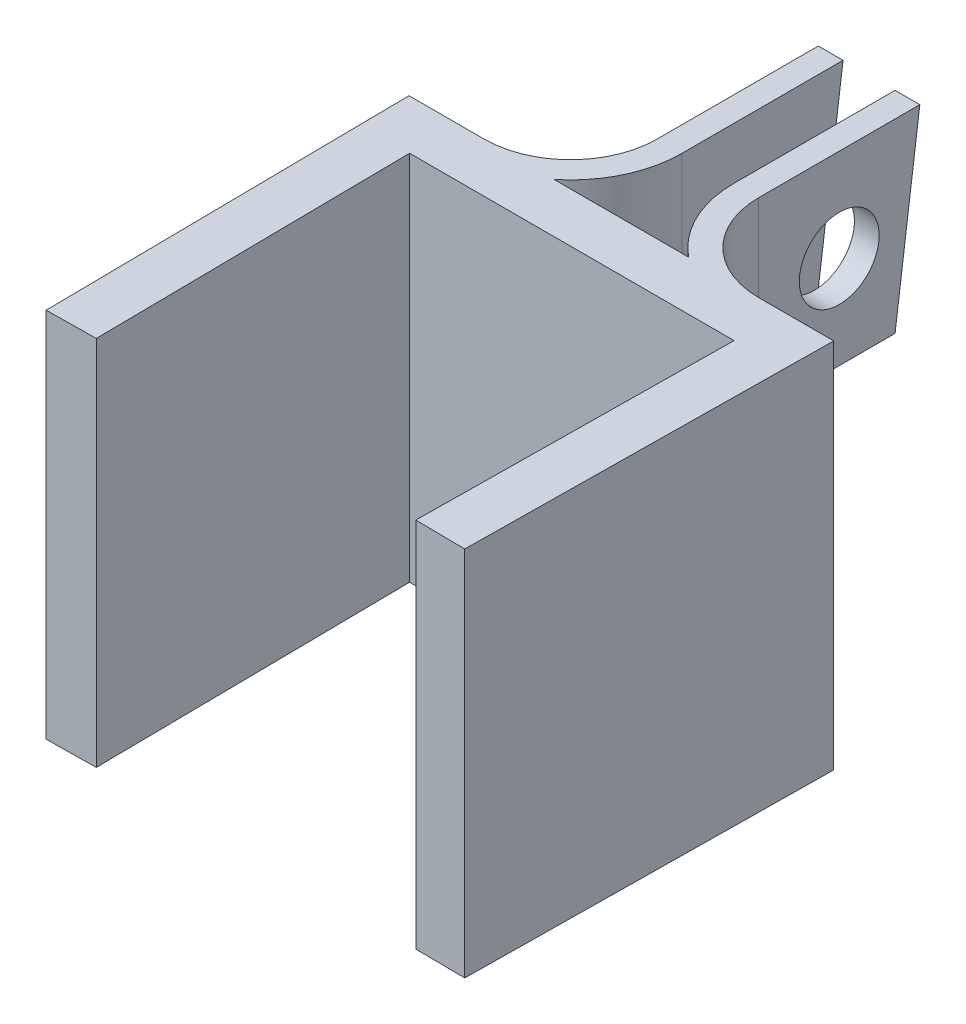
from build123d import *

# Parameters (mm, degrees)
BOSS_EXTRUDE1_DEPTH = 30
BOSS_EXTRUDE2_DEPTH = 15
SKETCH3_R           = 3.225
CUT_EXTRUDE1_DEPTH  = 15
CUT_EXTRUDE3_DEPTH  = 15


with BuildPart() as part:
    # Sketch1 → Boss-Extrude1 (new body)
    with BuildSketch(Plane(origin=(0, 0, 0), x_dir=(1, 0, 0), z_dir=(0, 1, 0))):
        Polygon((-12.8, -12.8), (-13.1, 12.8), (13.1, 12.8), (12.8, -12.6), (16.799721029, -12.6472408), (17.147523085, 16.8), (-17.147149649, 16.8), (-16.79972537, -12.846871782), align=None)
    extrude(amount=BOSS_EXTRUDE1_DEPTH)

    # Sketch2 → Boss-Extrude2 (add)
    with BuildSketch(Plane(origin=(0, 30, 0), x_dir=(1, 0, 0), z_dir=(0, 1, 0))):
        with BuildLine():
            Line((-4.099813282, 36.8), (-4.099813282, 23.785134539))
            ThreePointArc((-4.099813282, 23.785134539), (-6.145711821, 18.845898539), (-11.084947821, 16.8))
            Line((-11.084947821, 16.8), (-5.433351749, 16.8))
            ThreePointArc((-5.433351749, 16.8), (-2.975909846, 19.915231981), (-2.099813282, 23.785134539))
            Line((-2.099813282, 23.785134539), (-2.099813282, 36.8))
            Line((-2.099813282, 36.8), (-4.099813282, 36.8))
        make_face()
        with BuildLine():
            Line((4.100186718, 36.8), (2.100186718, 36.8))
            Line((2.100186718, 36.8), (2.100186718, 23.785134539))
            ThreePointArc((2.100186718, 23.785134539), (2.976283283, 19.915231981), (5.433725186, 16.8))
            Line((5.433725186, 16.8), (11.085321257, 16.8))
            ThreePointArc((11.085321257, 16.8), (6.146085257, 18.845898539), (4.100186718, 23.785134539))
            Line((4.100186718, 23.785134539), (4.100186718, 36.8))
        make_face()
    extrude(amount=-BOSS_EXTRUDE2_DEPTH)

    # Sketch3 → Cut-Extrude1 (cut)
    with BuildSketch(Plane.ZY.offset(4.099813282)):
        with Locations((-30.29256727, 22.5)):
            Circle(SKETCH3_R)
    extrude(amount=-CUT_EXTRUDE1_DEPTH, mode=Mode.SUBTRACT)

    # Sketch8 → Cut-Extrude3 (cut)
    with BuildSketch(Plane(origin=(4.100186718, 0, 0), x_dir=(0, 0, -1), z_dir=(1, 0, 0))):
        Polygon((36.8, 30), (36.8, 15), (34.8, 15), align=None)
    extrude(amount=-CUT_EXTRUDE3_DEPTH, mode=Mode.SUBTRACT)


solid = part.part
